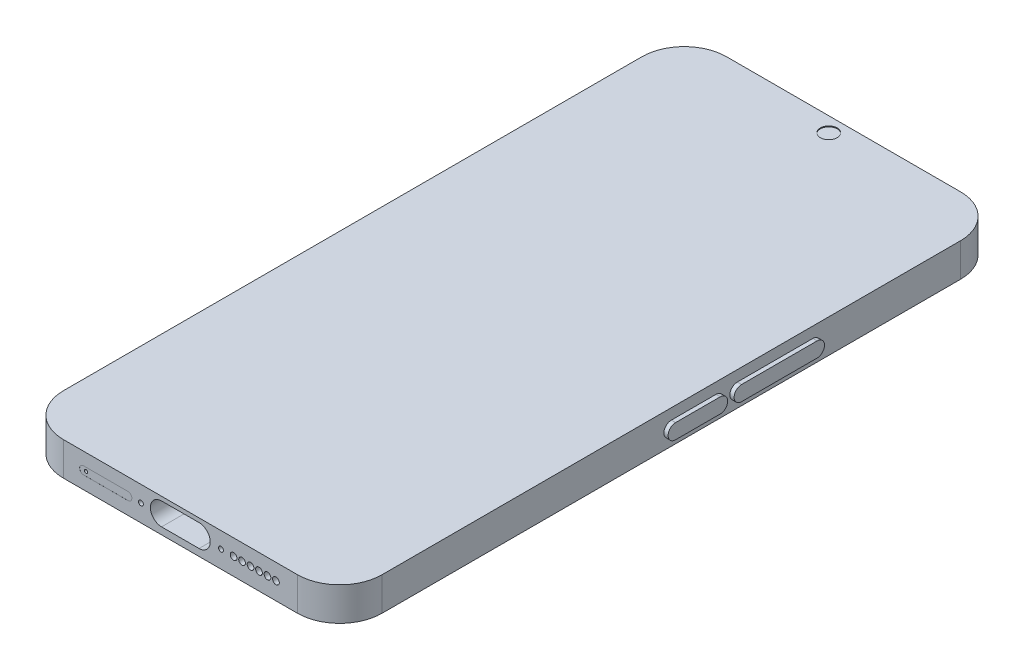
from build123d import *

# Parameters (mm, degrees)
SKETCH_1_W          = 75.3
SKETCH_1_H          = 156.7
EXTRUDE_1_DEPTH     = 7.9
FILLET_1_R          = 10
SKETCH_3_R          = 2
CUT_EXTRUDE_1_DEPTH = 0.2
CUT_EXTRUDE_2_DEPTH = 0.01
SKETCH_9_R          = 0.399671137
CUT_EXTRUDE_3_DEPTH = 0.6
CUT_EXTRUDE_4_DEPTH = 20.6
SKETCH_13_R         = 0.578075407
SKETCH_13_R_2       = 0.57807541
CUT_EXTRUDE_5_DEPTH = 20.6
SKETCH_15_R         = 0.7962645
CUT_EXTRUDE_6_DEPTH = 20.6
SKETCH_16_R         = 0.82420756
CUT_EXTRUDE_8_DEPTH = 5.6
EXTRUDE_2_DEPTH     = 1
SKETCH_19_W         = 0.215384615
SKETCH_19_H         = 3.5
CUT_EXTRUDE_9_DEPTH = 0.03


with BuildPart() as part:
    # 草图1 → 凸台-拉伸1 (new body)
    with BuildSketch(Plane(origin=(0, 0, 0), x_dir=(1, 0, 0), z_dir=(0, 1, 0))):
        Rectangle(SKETCH_1_W, SKETCH_1_H)
    extrude(amount=EXTRUDE_1_DEPTH)

    # 圆角1
    fillet_1_edges = [part.edges().sort_by_distance(p)[0] for p in [
        (37.65, 3.95, 78.35),
        (-37.65, 3.95, 78.35),
        (-37.65, 3.95, -78.35),
        (37.65, 3.95, -78.35),
    ]]
    fillet(fillet_1_edges, radius=FILLET_1_R)

    # 草图3 → 切除-拉伸1 (cut)
    with BuildSketch(Plane(origin=(0, 7.9, 0), x_dir=(1, 0, 0), z_dir=(0, 1, 0))):
        with Locations(Location((0, 74.852603511, 0), (0, 0, 270))):
            Circle(SKETCH_3_R)
    extrude(amount=-CUT_EXTRUDE_1_DEPTH, mode=Mode.SUBTRACT)

    # 草图6 → 切除-拉伸2 (cut)
    with BuildSketch(Plane.XY.offset(78.35)):
        with BuildLine():
            Line((-22.881883908, 4.909968629), (-12.412006908, 4.909968629))
            ThreePointArc((-12.412006908, 4.909968629), (-11.480217939, 3.97817966), (-12.412006908, 3.046390691))
            Line((-12.412006908, 3.046390691), (-22.881883908, 3.046390691))
            ThreePointArc((-22.881883908, 3.046390691), (-23.813672877, 3.97817966), (-22.881883908, 4.909968629))
        make_face()
    extrude(amount=-CUT_EXTRUDE_2_DEPTH, mode=Mode.SUBTRACT)

    # 草图9 → 切除-拉伸3 (cut)
    with BuildSketch(Plane.XY.offset(78.34)):
        with Locations((-22.318290708, 4.03453898)):
            Circle(SKETCH_9_R)
    extrude(amount=-CUT_EXTRUDE_3_DEPTH, mode=Mode.SUBTRACT)

    # 草图12 → 切除-拉伸4 (cut)
    with BuildSketch(Plane.XY.offset(78.35)):
        with BuildLine():
            Line((-4.452386278, 6.935183769), (4.396026958, 6.935183769))
            ThreePointArc((4.396026958, 6.935183769), (7.044914996, 4.286295731), (4.396026958, 1.637407692))
            Line((4.396026958, 1.637407692), (-4.452386278, 1.637407692))
            ThreePointArc((-4.452386278, 1.637407692), (-7.101274316, 4.286295731), (-4.452386278, 6.935183769))
        make_face()
    extrude(amount=-CUT_EXTRUDE_4_DEPTH, mode=Mode.SUBTRACT)

    # 草图13 → 切除-拉伸5 (cut)
    with BuildSketch(Plane.XY.offset(78.35)):
        with Locations((-9.346882, 4.086344457)):
            Circle(SKETCH_13_R)
        with Locations((9.58363279, 4.08634446)):
            Circle(SKETCH_13_R_2)
    extrude(amount=-CUT_EXTRUDE_5_DEPTH, mode=Mode.SUBTRACT)

    # 草图15 → 切除-拉伸6 (cut)
    with BuildSketch(Plane.XY.offset(78.35)):
        with Locations((12.568128353, 4.10177)):
            Circle(SKETCH_15_R)
        with Locations((14.568128353, 4.10177)):
            Circle(SKETCH_15_R)
        with Locations((16.568128353, 4.10177)):
            Circle(SKETCH_15_R)
        with Locations((18.568128353, 4.10177)):
            Circle(SKETCH_15_R)
        with Locations((20.568128353, 4.10177)):
            Circle(SKETCH_15_R)
        with Locations((22.568128353, 4.10177)):
            Circle(SKETCH_15_R)
    extrude(amount=-CUT_EXTRUDE_6_DEPTH, mode=Mode.SUBTRACT)

    # 草图16 → 切除-拉伸8 (cut)
    with BuildSketch(Plane(origin=(0, 0, -78.35), x_dir=(-1, 0, 0), z_dir=(0, 0, -1))):
        with Locations((-16.054001207, 4.05604766)):
            Circle(SKETCH_16_R)
        with Locations((-11.054001207, 4.05604766)):
            Circle(SKETCH_16_R)
    extrude(amount=-CUT_EXTRUDE_8_DEPTH, mode=Mode.SUBTRACT)

    # 草图17 → 凸台-拉伸2 (add)
    with BuildSketch(Plane(origin=(37.65, 0, 0), x_dir=(0, 0, -1), z_dir=(1, 0, 0))):
        with BuildLine():
            Line((15.598807748, 5.349724853), (33.432184038, 5.349724853))
            ThreePointArc((33.432184038, 5.349724853), (35.19144807, 3.590460821), (33.432184038, 1.83119679))
            Line((33.432184038, 1.83119679), (15.598807748, 1.83119679))
            ThreePointArc((15.598807748, 1.83119679), (13.839543716, 3.590460821), (15.598807748, 5.349724853))
        make_face()
        with BuildLine():
            Line((0, 5.349724851), (10.55558419, 5.349724851))
            ThreePointArc((10.55558419, 5.349724851), (12.31484822, 3.590460821), (10.55558419, 1.831196791))
            Line((10.55558419, 1.831196791), (0, 1.831196791))
            ThreePointArc((0, 1.831196791), (-1.75926403, 3.590460821), (0, 5.349724851))
        make_face()
    extrude(amount=EXTRUDE_2_DEPTH)

    # 草图19 → 切除-拉伸9 (cut)
    with BuildSketch(Plane.XZ):
        with BuildLine():
            add(Edge.make_bspline(
                [(-7.646153846, 51.760733272), (-7.644839495, 51.797841343), (-7.642242361, 51.871166186), (-7.622217175, 51.978533751), (-7.59052121, 52.081456816), (-7.544158851, 52.178470863), (-7.48662346, 52.271770862), (-7.414287328, 52.358620895), (-7.330517365, 52.44239319), (-7.266738309, 52.491707992), (-7.233894231, 52.517103464)],
                knots=[0, 0, 0, 0, 0.993209194, 1.962562481, 2.915098027, 3.86929026, 4.834181632, 5.842972081, 6.889202835, 8, 8, 8, 8], degree=3))
            add(Edge.make_bspline(
                [(-7.233894231, 52.517103464), (-7.201695642, 52.539493393), (-7.137726449, 52.583975643), (-7.036432661, 52.641223704), (-6.931590229, 52.689201419), (-6.823725715, 52.729138531), (-6.712126934, 52.759270996), (-6.597380859, 52.781031757), (-6.479278186, 52.795148788), (-6.399319185, 52.796558848), (-6.358894231, 52.797271733)],
                knots=[0, 0, 0, 0, 1.00671537, 2.000049456, 2.982911492, 3.964928827, 4.950294302, 5.947484796, 6.962307796, 8, 8, 8, 8], degree=3))
            add(Edge.make_bspline(
                [(-6.358894231, 52.797271733), (-6.317628186, 52.796567554), (-6.236270641, 52.795179239), (-6.116208514, 52.78103666), (-5.999793675, 52.759250084), (-5.886740914, 52.729291281), (-5.77779554, 52.689198143), (-5.672132462, 52.641208304), (-5.570111198, 52.584209386), (-5.5059782, 52.539524883), (-5.473798077, 52.517103464)],
                knots=[0, 0, 0, 0, 1.04833736, 2.066836155, 3.067725592, 4.056667035, 5.035228992, 6.014413708, 7.003688989, 8, 8, 8, 8], degree=3))
            add(Edge.make_bspline(
                [(-5.473798077, 52.517103464), (-5.440962088, 52.491703212), (-5.377198741, 52.442379129), (-5.293317523, 52.358672571), (-5.221283372, 52.271472613), (-5.162346747, 52.178961213), (-5.117439669, 52.081192816), (-5.085392617, 51.978574707), (-5.065471323, 51.871155577), (-5.062859996, 51.797837778), (-5.061538462, 51.760733272)],
                knots=[0, 0, 0, 0, 1.110682167, 2.156804608, 3.165490619, 4.134277957, 5.085203766, 6.037640698, 7.006893631, 8, 8, 8, 8], degree=3))
            Line((-5.061538462, 51.760733272), (-5.061538462, 49.297271733))
            Line((-5.061538462, 49.297271733), (-5.276923077, 49.297271733))
            Line((-5.276923077, 49.297271733), (-5.276923077, 51.703521733))
            add(Edge.make_bspline(
                [(-5.276923077, 51.703521733), (-5.277697856, 51.734739865), (-5.27922447, 51.796251691), (-5.297232044, 51.886254408), (-5.323952242, 51.972435284), (-5.361292074, 52.055290176), (-5.410784745, 52.133795044), (-5.470849129, 52.20858854), (-5.540962845, 52.280143715), (-5.594445586, 52.322211216), (-5.621875, 52.343786156)],
                knots=[0, 0, 0, 0, 0.989958482, 1.950602127, 2.902621034, 3.851176449, 4.827258207, 5.841161343, 6.892807689, 8, 8, 8, 8], degree=3))
            add(Edge.make_bspline(
                [(-5.621875, 52.343786156), (-5.648807912, 52.362702476), (-5.702477359, 52.40039719), (-5.787465398, 52.44946878), (-5.876130777, 52.489236487), (-5.966622188, 52.523640198), (-6.060413558, 52.549751201), (-6.157292446, 52.567734943), (-6.256755411, 52.580470436), (-6.324077661, 52.581411962), (-6.358052885, 52.581887118)],
                knots=[0, 0, 0, 0, 1.00308994, 1.998865965, 2.98594187, 3.962595082, 4.947929163, 5.948976593, 6.964919062, 8, 8, 8, 8], degree=3))
            add(Edge.make_bspline(
                [(-6.358052885, 52.581887118), (-6.391750651, 52.581420436), (-6.458519747, 52.580495747), (-6.55710455, 52.567638289), (-6.653364666, 52.550092599), (-6.746118084, 52.522213684), (-6.836924226, 52.489129859), (-6.924092784, 52.446207655), (-7.009979076, 52.398175038), (-7.063191978, 52.359221398), (-7.090024038, 52.339579425)],
                knots=[0, 0, 0, 0, 1.029376059, 2.039616195, 3.035013871, 4.017179626, 4.996534958, 5.985859015, 6.984390068, 8, 8, 8, 8], degree=3))
            add(Edge.make_bspline(
                [(-7.090024038, 52.339579425), (-7.117189078, 52.318012746), (-7.170163187, 52.27595591), (-7.239118308, 52.204419986), (-7.298652017, 52.130464565), (-7.347371383, 52.052378141), (-7.384344764, 51.970130946), (-7.41159499, 51.884693831), (-7.428180722, 51.795311313), (-7.42989727, 51.734441813), (-7.430769231, 51.703521733)],
                knots=[0, 0, 0, 0, 1.109433663, 2.163488775, 3.173162266, 4.144953063, 5.10135613, 6.052687647, 7.010817341, 8, 8, 8, 8], degree=3))
            Line((-7.430769231, 51.703521733), (-7.430769231, 49.297271733))
            Line((-7.430769231, 49.297271733), (-7.646153846, 49.297271733))
            Line((-7.646153846, 49.297271733), (-7.646153846, 51.760733272))
        make_face()
        Polygon((-1.6625, 52.581887118), (-3.932451923, 52.581887118), (-3.932451923, 52.797271733), (-1.239302885, 52.797271733), (-3.630408654, 49.512656348), (-1.418509615, 49.512656348), (-1.418509615, 49.297271733), (-4.053605769, 49.297271733), align=None)
        with Locations((-0.107692308, 51.047271733)):
            Rectangle(SKETCH_19_W, SKETCH_19_H)
        Polygon((3.553846154, 52.797271733), (3.553846154, 49.297271733), (1.171995192, 49.297271733), (1.171995192, 49.512656348), (3.338461538, 49.512656348), (3.338461538, 50.858810195), (2.025120192, 50.858810195), (2.025120192, 51.07419481), (3.338461538, 51.07419481), (3.338461538, 52.581887118), (1.171995192, 52.581887118), (1.171995192, 52.797271733), align=None)
        Polygon((5.007692308, 52.797271733), (5.007692308, 49.889579425), (6.151923077, 52.797271733), (6.311778846, 52.797271733), (7.484615385, 49.889579425), (7.484615385, 52.797271733), (7.7, 52.797271733), (7.7, 49.297271733), (7.495552885, 49.287175579), (6.232692308, 52.417824618), (4.997596154, 49.277079425), (4.792307692, 49.297271733), (4.792307692, 52.797271733), align=None)
    extrude(amount=-CUT_EXTRUDE_9_DEPTH, mode=Mode.SUBTRACT)


solid = part.part
